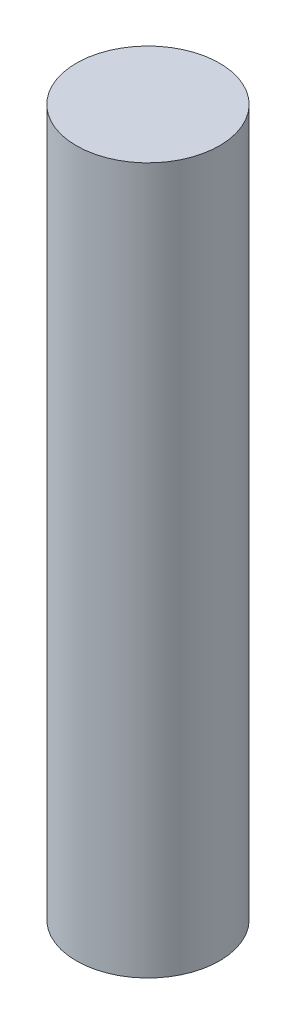
from build123d import *

# Parameters (mm, degrees)
SKETCH_1_R      = 3.65
EXTRUDE_1_DEPTH = 36


with BuildPart() as part:
    # 草图1 → 凸台-拉伸1 (new body)
    with BuildSketch(Plane(origin=(0, 0, 0), x_dir=(1, 0, 0), z_dir=(0, 1, 0))):
        with Locations(Location((0, 0, 0), (0, 0, 270))):
            Circle(SKETCH_1_R)
    extrude(amount=EXTRUDE_1_DEPTH)


solid = part.part
